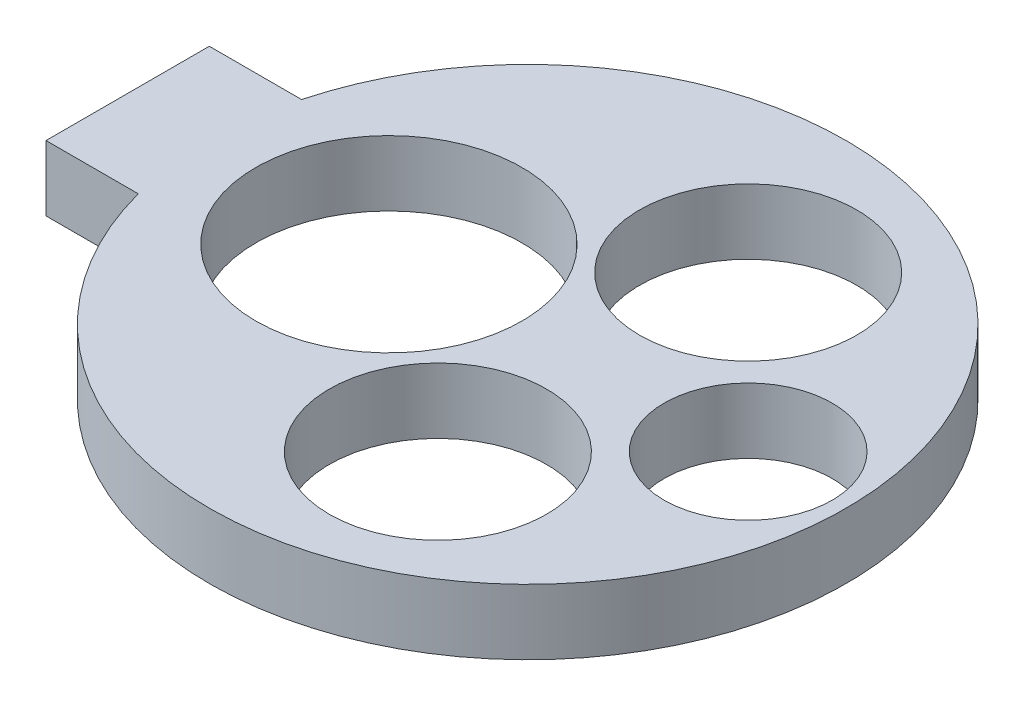
from build123d import *

# Parameters (mm, degrees)
SKETCH1_R             = 19.5
SKETCH1_R_2           = 8.15
SKETCH1_R_3           = 6.65
SKETCH1_R_4           = 5.15
DISCO_SEPARADOR_DEPTH = 4
SKETCH2_W             = 7
SKETCH2_H             = 10
PATA_AL_HUESO_DEPTH   = 4


with BuildPart() as part:
    # Sketch1 → Disco_separador (new body)
    with BuildSketch(Plane(origin=(0, -2, 0), x_dir=(1, 0, 0), z_dir=(0, 1, 0))):
        with Locations(Location((0, 0, 0), (0, 0, 270))):
            Circle(SKETCH1_R)
        with Locations(Location((-8.5, 0, 0), (0, 0, 270))):
            Circle(SKETCH1_R_2, mode=Mode.SUBTRACT)
        with Locations(Location((4, -9.5, 0), (0, 0, 270))):
            Circle(SKETCH1_R_3, mode=Mode.SUBTRACT)
        with Locations(Location((4, 9.5, 0), (0, 0, 270))):
            Circle(SKETCH1_R_3, mode=Mode.SUBTRACT)
        with Locations(Location((13.5, 0, 0), (0, 0, 270))):
            Circle(SKETCH1_R_4, mode=Mode.SUBTRACT)
    extrude(amount=DISCO_SEPARADOR_DEPTH)

    # Sketch2 → Pata_al_hueso (add)
    with BuildSketch(Plane(origin=(0, -2, 0), x_dir=(1, 0, 0), z_dir=(0, 1, 0))):
        with Locations((-21, 0)):
            Rectangle(SKETCH2_W, SKETCH2_H)
    extrude(amount=PATA_AL_HUESO_DEPTH)


solid = part.part
